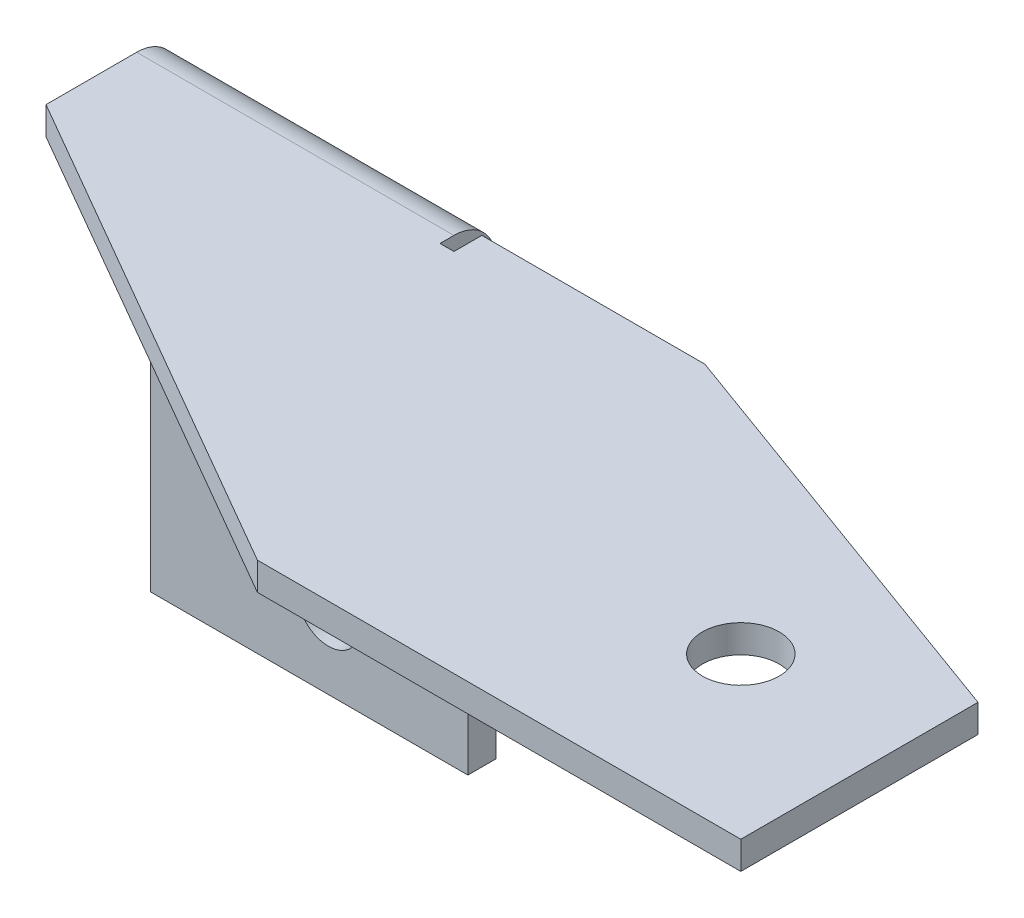
from build123d import *

# Parameters (mm, degrees)
EXTRUDE_1_DEPTH      = 2
SKETCH_2_R           = 2.75
CUT_EXTRUDE_1_DEPTH  = 76.957158978
EXTRUDE_2_DEPTH      = 32
EXTRUDE_2_DEPTH_BACK = 2
SKETCH_3_W           = 22.737902435
SKETCH_3_H           = 2
CUT_EXTRUDE_2_DEPTH  = 83.398361634
SKETCH_7_W           = 1
SKETCH_7_H           = 2
CUT_EXTRUDE_3_DEPTH  = 2
FILLET_1_R           = 3
FILLET_2_R           = 1


with BuildPart() as part:
    # 草图1 → 凸台-拉伸1 (new body)
    with BuildSketch(Plane(origin=(0, 0, 0), x_dir=(1, 0, 0), z_dir=(0, 1, 0))):
        Polygon((0, 0), (39.728252902, 0), (70.5, -11.2), (70.5, -28.2), (35.853451717, -28.2), (0, -7.5), align=None)
    extrude(amount=EXTRUDE_1_DEPTH)

    # 草图2 → 切除-拉伸1 (cut, through all)
    with BuildSketch(Plane(origin=(0, 2, 0), x_dir=(1, 0, 0), z_dir=(0, 1, 0))):
        with Locations(Location((59, -16.7, 0), (0, 0, 270))):
            Circle(SKETCH_2_R)
    extrude(amount=-CUT_EXTRUDE_1_DEPTH, mode=Mode.SUBTRACT)

    # 草图3 → 凸台-拉伸2 (add, two sides: drawn at the far end of the back side and taken through both)
    with BuildSketch(Plane.XZ.offset(-EXTRUDE_2_DEPTH_BACK)):
        with Locations((11.368951218, -1)):
            Rectangle(SKETCH_3_W, SKETCH_3_H)
    extrude(amount=EXTRUDE_2_DEPTH + EXTRUDE_2_DEPTH_BACK)

    # 草图4 → 切除-拉伸2 (cut, through all)
    with BuildSketch(Plane(origin=(0, 0, 0), x_dir=(-1, 0, 0), z_dir=(0, 0, -1))):
        with BuildLine():
            Line((-14.987902435, -26.75), (-14.987902435, -21.25))
            ThreePointArc((-14.987902435, -21.25), (-12.737902435, -19), (-10.487902435, -21.25))
            Line((-10.487902435, -21.25), (-10.487902435, -26.75))
            ThreePointArc((-10.487902435, -26.75), (-12.737902435, -29), (-14.987902435, -26.75))
        make_face()
        with BuildLine():
            Line((-14.987902435, -12.25), (-14.987902435, -6.75))
            ThreePointArc((-14.987902435, -6.75), (-12.737902435, -4.5), (-10.487902435, -6.75))
            Line((-10.487902435, -6.75), (-10.487902435, -12.25))
            ThreePointArc((-10.487902435, -12.25), (-12.737902435, -14.5), (-14.987902435, -12.25))
        make_face()
    extrude(amount=CUT_EXTRUDE_2_DEPTH, mode=Mode.SUBTRACT)

    # 草图7 → 切除-拉伸3 (cut)
    with BuildSketch(Plane(origin=(0, 2, 0), x_dir=(1, 0, 0), z_dir=(0, 1, 0))):
        with Locations((23.237902435, -1)):
            Rectangle(SKETCH_7_W, SKETCH_7_H)
    extrude(amount=-CUT_EXTRUDE_3_DEPTH, mode=Mode.SUBTRACT)

    # 圆角1
    fillet_1_edges = [part.edges().sort_by_distance(p)[0] for p in [
        (11.368951218, 2, -2),
    ]]
    fillet(fillet_1_edges, radius=FILLET_1_R)

    # 圆角2
    fillet_2_edges = [part.edges().sort_by_distance(p)[0] for p in [
        (11.368951218, 0, 0),
    ]]
    fillet(fillet_2_edges, radius=FILLET_2_R)


solid = part.part
